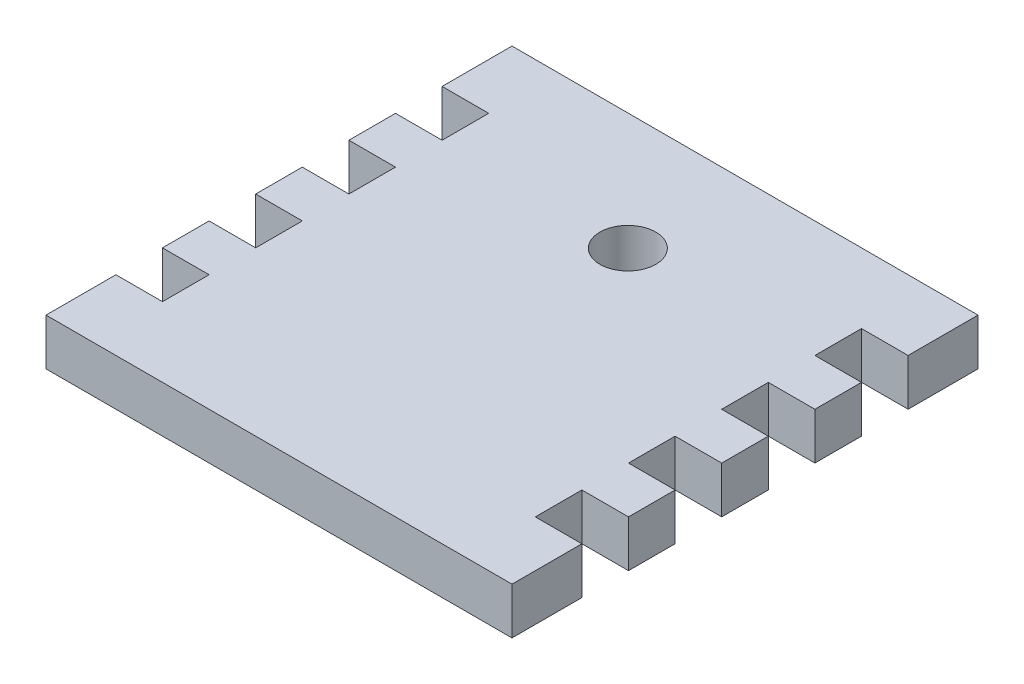
from build123d import *

# Parameters (mm, degrees)
SKETCH1_W           = 50.8
SKETCH1_H           = 50.8
BOSS_EXTRUDE1_DEPTH = 5.08
SKETCH2_R           = 3.048
SKETCH2_W           = 5.08
SKETCH2_H           = 5.08
CUT_EXTRUDE1_DEPTH  = 5.08


with BuildPart() as part:
    # Sketch1 → Boss-Extrude1 (new body)
    with BuildSketch(Plane(origin=(0, 0, 0), x_dir=(1, 0, 0), z_dir=(0, 1, 0))):
        with Locations((9.389105058, -7.511284047)):
            Rectangle(SKETCH1_W, SKETCH1_H)
    extrude(amount=BOSS_EXTRUDE1_DEPTH)

    # Sketch2 → Cut-Extrude1 (cut)
    with BuildSketch(Plane(origin=(0, 5.08, 0), x_dir=(1, 0, 0), z_dir=(0, 1, 0))):
        with Locations(Location((9.389105058, 5.120135953, 0), (0, 0, 270))):
            Circle(SKETCH2_R)
        with Locations((32.249105058, -22.751284047)):
            Rectangle(SKETCH2_W, SKETCH2_H)
        with Locations((-13.470894942, -12.591284047)):
            Rectangle(SKETCH2_W, SKETCH2_H)
        with Locations((-13.470894942, -22.751284047)):
            Rectangle(SKETCH2_W, SKETCH2_H)
        with Locations((32.249105058, -12.591284047)):
            Rectangle(SKETCH2_W, SKETCH2_H)
        with Locations((32.249105058, -2.431284047)):
            Rectangle(SKETCH2_W, SKETCH2_H)
        with Locations((32.249105058, 7.728715953)):
            Rectangle(SKETCH2_W, SKETCH2_H)
        with Locations((-13.470894942, 7.728715953)):
            Rectangle(SKETCH2_W, SKETCH2_H)
        with Locations((-13.470894942, -2.431284047)):
            Rectangle(SKETCH2_W, SKETCH2_H)
    extrude(amount=-CUT_EXTRUDE1_DEPTH, mode=Mode.SUBTRACT)


solid = part.part
